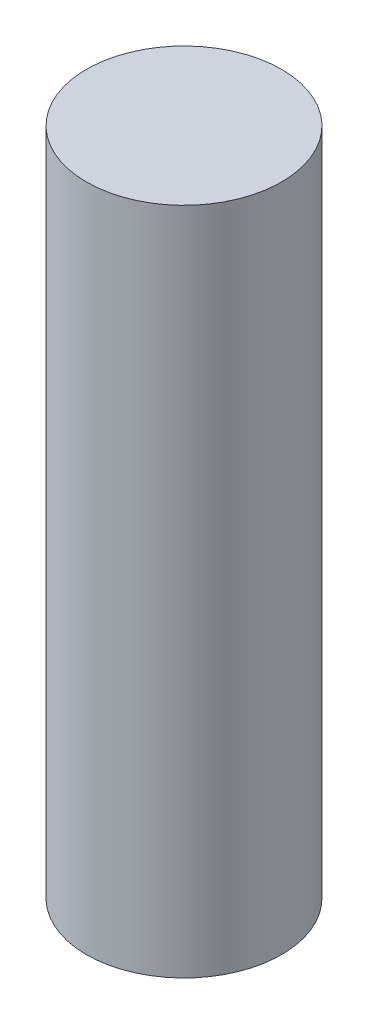
from build123d import *

# Parameters (mm, degrees)
SKETCH1_R           = 3.5
BOSS_EXTRUDE1_DEPTH = 24


with BuildPart() as part:
    # Sketch1 → Boss-Extrude1 (new body)
    with BuildSketch(Plane(origin=(0, 0, 0), x_dir=(1, 0, 0), z_dir=(0, 1, 0))):
        with Locations(Location((0, 0, 0), (0, 0, 270))):
            Circle(SKETCH1_R)
    extrude(amount=BOSS_EXTRUDE1_DEPTH)


solid = part.part
